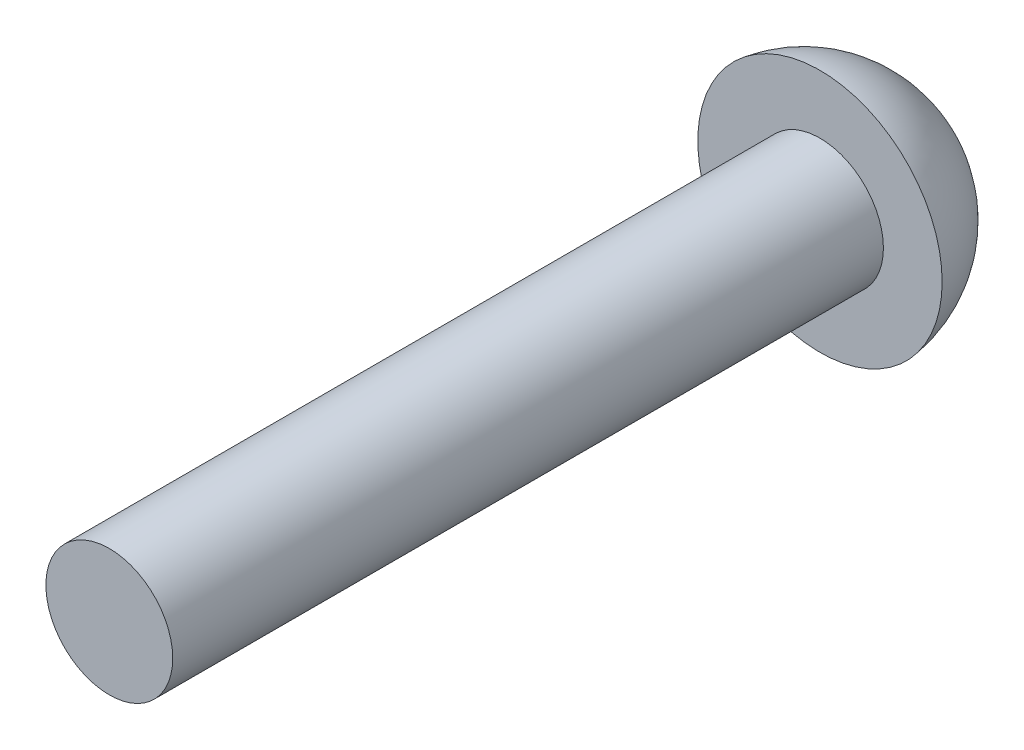
from build123d import *


with BuildPart() as part:
    # Sketch1 → Revolve1 (revolve)
    with BuildSketch(Plane(origin=(0, 0, 0), x_dir=(1, 0, 0), z_dir=(0, 1, 0))):
        with BuildLine():
            Line((0, 0), (0, 21.92))
            ThreePointArc((0, 21.92), (2.177299072, 21.100972809), (3.275, 19.05))
            Line((3.275, 19.05), (1.7, 19.05))
            Line((1.7, 19.05), (1.7, 0))
            Line((1.7, 0), (0, 0))
        make_face()
    revolve(axis=Axis((0, 0, 0), (0, 0, -1)))


solid = part.part
